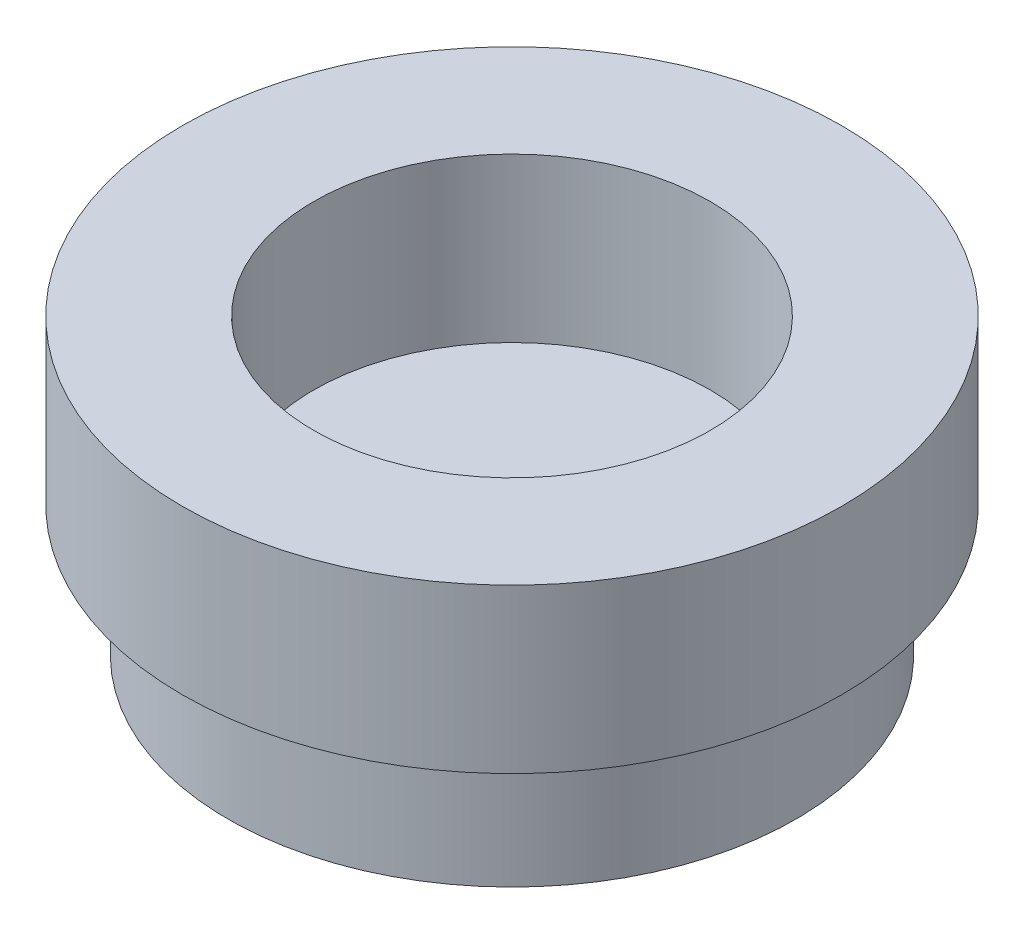
from build123d import *


with BuildPart() as part:
    # Sketch1 → Revolve1 (revolve)
    with BuildSketch(Plane.XY, mode=Mode.PRIVATE) as revolve1_sk:
        Polygon((0, 0), (-4.35, 0), (-4.35, 2), (-5.05, 2), (-5.05, 4.5), (-3.0375, 4.5), (-3.0375, 2), (0, 2), align=None)
    revolve(revolve1_sk.sketch.rotate(Axis((0, 0, 0), (0, 1, 0)), 270), axis=Axis((0, 0, 0), (0, 1, 0)))


solid = part.part
